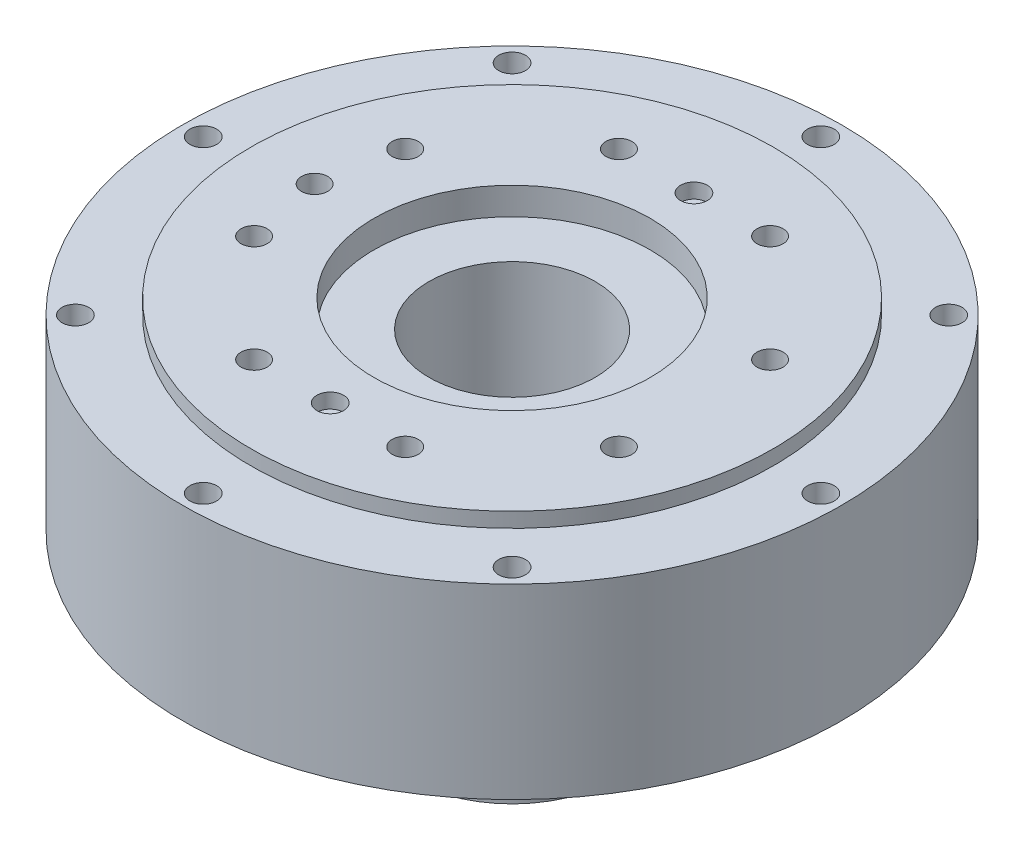
from build123d import *

# Parameters (mm, degrees)
SKETCH2_R          = 4.5
CUT_EXTRUDE1_DEPTH = 197.292186549
SKETCH4_R          = 4.4
CUT_EXTRUDE3_DEPTH = 18
SKETCH5_R          = 4.5
CUT_EXTRUDE4_DEPTH = 5
SKETCH6_R          = 1.5
CUT_EXTRUDE5_DEPTH = 8


with BuildPart() as part:
    # Sketch1 → Revolve1 (revolve)
    with BuildSketch(Plane(origin=(0, 0, 0), x_dir=(0, 0, -1), z_dir=(1, 0, 0)), mode=Mode.PRIVATE) as revolve1_sk:
        Polygon((-28, 0), (-35, 0), (-35, 34), (-39.3, 34), (-39.3, 44), (-84.5, 44), (-84.5, 55), (-95, 55), (-95.5, 57), (-97.5, 57), (-98, 55), (-111, 55), (-111, 117.85), (-88, 117.85), (-88, 122.85), (-46.5, 122.85), (-46.5, 113.65), (-28, 113.65), align=None)
    revolve(revolve1_sk.sketch.rotate(Axis((0, 0, 0), (0, 1, 0)), 180), axis=Axis((0, 0, 0), (0, 1, 0)))

    # Sketch2 → Cut-Extrude1 (cut, through all)
    with BuildSketch(Plane(origin=(0, 117.85, 0), x_dir=(1, 0, 0), z_dir=(0, 1, 0))):
        with Locations(Location((-104, 0, 0), (0, 0, 270))):
            Circle(SKETCH2_R)
        with Locations(Location((-73.539105243, 73.539105243, 0), (0, 0, 270))):
            Circle(SKETCH2_R)
        with Locations(Location((0, 104, 0), (0, 0, 270))):
            Circle(SKETCH2_R)
        with Locations(Location((73.539105243, 73.539105243, 0), (0, 0, 270))):
            Circle(SKETCH2_R)
        with Locations(Location((104, 0, 0), (0, 0, 270))):
            Circle(SKETCH2_R)
        with Locations(Location((73.539105243, -73.539105243, 0), (0, 0, 270))):
            Circle(SKETCH2_R)
        with Locations(Location((0, -104, 0), (0, 0, 270))):
            Circle(SKETCH2_R)
        with Locations(Location((-73.539105243, -73.539105243, 0), (0, 0, 270))):
            Circle(SKETCH2_R)
    extrude(amount=-CUT_EXTRUDE1_DEPTH, mode=Mode.SUBTRACT)

    # Sketch4 → Cut-Extrude3 (cut)
    with BuildSketch(Plane(origin=(0, 122.85, 0), x_dir=(1, 0, 0), z_dir=(0, 1, 0))):
        with Locations(Location((-66.5, 0, 0), (0, 0, 270))):
            Circle(SKETCH4_R)
        with Locations(Location((-61.437988912, 25.448448252, 0), (0, 0, 270))):
            Circle(SKETCH4_R)
        with Locations(Location((-25.448448252, 61.437988912, 0), (0, 0, 270))):
            Circle(SKETCH4_R)
        with Locations(Location((25.448448252, 61.437988912, 0), (0, 0, 270))):
            Circle(SKETCH4_R)
        with Locations(Location((61.437988912, 25.448448252, 0), (0, 0, 270))):
            Circle(SKETCH4_R)
        with Locations(Location((61.437988912, -25.448448252, 0), (0, 0, 270))):
            Circle(SKETCH4_R)
        with Locations(Location((25.448448252, -61.437988912, 0), (0, 0, 270))):
            Circle(SKETCH4_R)
        with Locations(Location((-25.448448252, -61.437988912, 0), (0, 0, 270))):
            Circle(SKETCH4_R)
        with Locations(Location((-61.437988912, -25.448448252, 0), (0, 0, 270))):
            Circle(SKETCH4_R)
    extrude(amount=-CUT_EXTRUDE3_DEPTH, mode=Mode.SUBTRACT)

    # Sketch5 → Cut-Extrude4 (cut)
    with BuildSketch(Plane(origin=(0, 122.85, 0), x_dir=(1, 0, 0), z_dir=(0, 1, 0))):
        with Locations(Location((0, -61.25, 0), (0, 0, 270))):
            Circle(SKETCH5_R)
        with Locations(Location((0, 61.25, 0), (0, 0, 270))):
            Circle(SKETCH5_R)
    extrude(amount=-CUT_EXTRUDE4_DEPTH, mode=Mode.SUBTRACT)

    # Sketch6 → Cut-Extrude5 (cut)
    with BuildSketch(Plane.XZ):
        with Locations(Location((0, 31.5, 0), (0, 0, 270))):
            Circle(SKETCH6_R)
        with Locations(Location((27.279800219, 15.75, 0), (0, 0, 270))):
            Circle(SKETCH6_R)
        with Locations(Location((27.279800219, -15.75, 0), (0, 0, 270))):
            Circle(SKETCH6_R)
        with Locations(Location((0, -31.5, 0), (0, 0, 270))):
            Circle(SKETCH6_R)
        with Locations(Location((-27.279800219, -15.75, 0), (0, 0, 270))):
            Circle(SKETCH6_R)
        with Locations(Location((-27.279800219, 15.75, 0), (0, 0, 270))):
            Circle(SKETCH6_R)
    extrude(amount=-CUT_EXTRUDE5_DEPTH, mode=Mode.SUBTRACT)


solid = part.part
